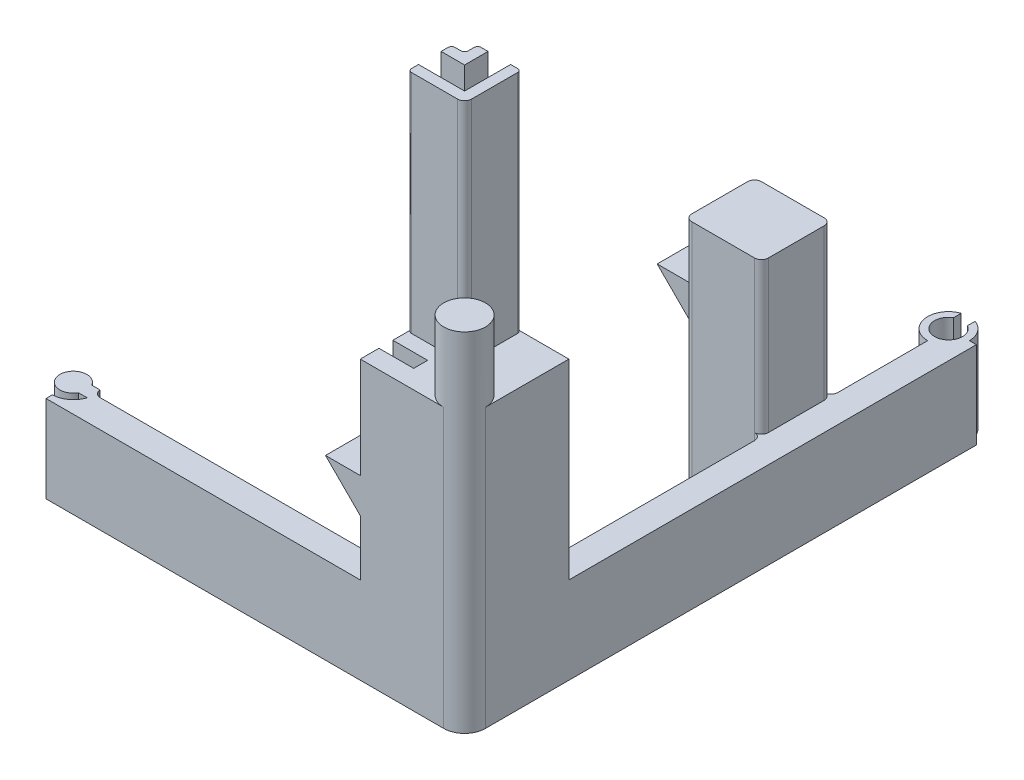
from build123d import *
from build123d.topology import SkipClean

# Parameters (mm, degrees)
SKETCH1_W                 = 30
SKETCH1_H                 = 30
BOSS_EXTRUDE1_DEPTH       = 80
SKETCH2_R                 = 6
BOSS_EXTRUDE2_DEPTH       = 20
CUT_EXTRUDE1_DEPTH        = 83.764726786
BOSS_EXTRUDE3_DEPTH       = 65
BOSS_EXTRUDE5_DEPTH       = 2
BOSS_EXTRUDE6_DEPTH       = 23
BOSS_EXTRUDE7_DEPTH       = 25
FILLET1_R                 = 2
SKETCH11_R                = 6.055782361
CUT_EXTRUDE2_DEPTH        = 2.125
SKETCH12_W                = 13.25
SKETCH12_H                = 8.5
CUT_EXTRUDE3_DEPTH        = 13.25
FILLET2_R                 = 2
CUT_EXTRUDE4_REACH        = 195.534
SKETCH14_W                = 3.75
SKETCH14_H                = 3.75
FILLET3_R                 = 1
SKETCH15_W                = 10
SKETCH15_H                = 4
CUT_EXTRUDE5_DEPTH        = 25
BOSS_EXTRUDE8_REACH       = 230.211
SKETCH17_W                = 22
SKETCH17_H                = 20
SKETCH18_W                = 17
SKETCH18_H                = 15
CUT_EXTRUDE6_DEPTH        = 66
FILLET4_R                 = 2
FILLET5_R                 = 2
CHAMFER1_SIZE             = 7
BOSS_EXTRUDE9_DEPTH       = 30
BOSS_EXTRUDE10_DEPTH      = 8
BOSS_EXTRUDE10_DEPTH_BACK = 8


with BuildPart() as part:
    # Sketch1 → Boss-Extrude1 (new body)
    with BuildSketch(Plane(origin=(0, 0, 0), x_dir=(1, 0, 0), z_dir=(0, 1, 0))):
        Rectangle(SKETCH1_W, SKETCH1_H)
    extrude(amount=BOSS_EXTRUDE1_DEPTH)

    # Sketch2 → Boss-Extrude2 (add)
    with BuildSketch(Plane(origin=(0, 80, 0), x_dir=(1, 0, 0), z_dir=(0, 1, 0))):
        with Locations(Location((9, -9, 0), (0, 0, 270))):
            Circle(SKETCH2_R)
    extrude(amount=BOSS_EXTRUDE2_DEPTH)

    # Sketch3 → Cut-Extrude1 (cut, through all)
    with BuildSketch(Plane(origin=(0, 80, 0), x_dir=(1, 0, 0), z_dir=(0, 1, 0))):
        with BuildLine():
            Line((9, -15), (15, -15))
            Line((15, -15), (15, -9))
            ThreePointArc((15, -9), (13.242640687, -13.242640687), (9, -15))
        make_face()
    extrude(amount=-CUT_EXTRUDE1_DEPTH, mode=Mode.SUBTRACT)

    # Sketch4 → Boss-Extrude3 (add)
    with BuildSketch(Plane(origin=(0, 80, 0), x_dir=(1, 0, 0), z_dir=(0, 1, 0))):
        Polygon((-8.25, 11.25), (-8.25, 8.25), (-11.25, 8.25), (-15, 8.25), (-15, 11.25), (-11.25, 11.25), (-11.25, 15), (-8.25, 15), align=None)
        Polygon((-1.75, 1.75), (-11.25, 1.75), (-15, 1.75), (-15, -1.25), (-11.25, -1.25), (1.25, -1.25), (1.25, 11.25), (1.25, 15), (-1.75, 15), (-1.75, 11.25), align=None)
    extrude(amount=BOSS_EXTRUDE3_DEPTH)

    # Sketch6 → Boss-Extrude5 (add)
    with BuildSketch(Plane.XZ):
        with BuildLine():
            Line((15, -15), (7, -15))
            Line((7, -15), (7, -126.175))
            ThreePointArc((7, -126.175), (2.757359313, -136.417640687), (13, -132.175))
            Line((13, -132.175), (15, -132.175))
            Line((15, -132.175), (15, -15))
        make_face()
    extrude(amount=-BOSS_EXTRUDE5_DEPTH)

    # Sketch7 → Boss-Extrude6 (add)
    with SkipClean():  # the faces are left unmerged after this step: merging them gives an invalid solid
        with BuildSketch(Plane(origin=(0, 2, 0), x_dir=(1, 0, 0), z_dir=(0, 1, 0))):
            with BuildLine():
                Line((9, 137.831854249), (9, 135.639101615))
                ThreePointArc((9, 135.639101615), (7, 128.175), (5, 135.639101615))
                Line((5, 135.639101615), (5, 137.831854249))
                ThreePointArc((5, 137.831854249), (1.086408642, 131.160388128), (7, 126.175))
                Line((7, 126.175), (7, 15))
                Line((7, 15), (15, 15))
                Line((15, 15), (15, 132.175))
                Line((15, 132.175), (13, 132.175))
                ThreePointArc((13, 132.175), (11.898979486, 135.639101615), (9, 137.831854249))
            make_face()
        extrude(amount=BOSS_EXTRUDE6_DEPTH)

    # Sketch9 → Boss-Extrude7 (add)
    with SkipClean():  # the faces are left unmerged after this step: merging them gives an invalid solid
        with BuildSketch(Plane.XZ):
            with BuildLine():
                Line((-15, 15), (-15, 7))
                Line((-15, 7), (-99.5, 7))
                ThreePointArc((-99.5, 7), (-99.577697751, 6.037536458), (-99.80877869, 5.1))
                Line((-99.80877869, 5.1), (-102.122778509, 5.1))
                ThreePointArc((-102.122778509, 5.1), (-109.375, 7), (-102.122778509, 8.9))
                Line((-102.122778509, 8.9), (-99.625, 8.9))
                ThreePointArc((-99.625, 8.9), (-101.816885554, 11.955834237), (-105.375001601, 13.173329766))
                Line((-105.375001601, 13.173329766), (-105.375001601, 15))
                Line((-105.375001601, 15), (-15, 15))
            make_face()
        extrude(amount=-BOSS_EXTRUDE7_DEPTH)

    # Fillet1
    fillet1_edges = [part.edges().sort_by_distance(p)[0] for p in [
        (-99.5, 12.5, 7),
    ]]
    fillet(fillet1_edges, radius=FILLET1_R)

    # Sketch11 → Cut-Extrude2 (cut)
    with SkipClean():  # the faces are left unmerged after this step: merging them gives an invalid solid
        with BuildSketch(Plane.XZ):
            with Locations((-105.5, 7)):
                Circle(SKETCH11_R)
        extrude(amount=-CUT_EXTRUDE2_DEPTH, mode=Mode.SUBTRACT)

    # Sketch12 → Cut-Extrude3 (cut)
    with SkipClean():  # the faces are left unmerged after this step: merging them gives an invalid solid
        with BuildSketch(Plane(origin=(0, 0, -15), x_dir=(-1, 0, 0), z_dir=(0, 0, -1))):
            with Locations((8.375, 72.75)):
                Rectangle(SKETCH12_W, SKETCH12_H)
        extrude(amount=-CUT_EXTRUDE3_DEPTH, mode=Mode.SUBTRACT)

    # Fillet2
    fillet2_edges = [part.edges().sort_by_distance(p)[0] for p in [
        (1.25, 112.5, 1.25),
    ]]
    fillet(fillet2_edges, radius=FILLET2_R)

    # Sketch14 → Cut-Extrude4 (cut, up to next)
    with BuildSketch(Plane(origin=(0, 80, 0), x_dir=(1, 0, 0), z_dir=(0, 1, 0)), mode=Mode.PRIVATE) as cut_extrude4_sk1:
        with Locations((-13.125, 13.125)):
            Rectangle(SKETCH14_W, SKETCH14_H)
    cut_extrude4_tool1 = extrude(cut_extrude4_sk1.sketch, amount=-CUT_EXTRUDE4_REACH, mode=Mode.PRIVATE) & part.part
    add(cut_extrude4_tool1.solids().sort_by_distance((-13.125, 80, -13.125))[0], mode=Mode.SUBTRACT)

    # Fillet3
    fillet3_edges = [part.edges().sort_by_distance(p)[0] for p in [
        (-11.25, 112.5, -15),
        (-11.25, 112.5, -11.25),
        (-15, 112.5, -11.25),
        (-15, 112.5, 1.25),
        (1.25, 112.5, -15),
    ]]
    fillet(fillet3_edges, radius=FILLET3_R)

    # Sketch15 → Cut-Extrude5 (cut)
    with SkipClean():  # the faces are left unmerged after this step: merging them gives an invalid solid
        with BuildSketch(Plane(origin=(0, 80, 0), x_dir=(1, 0, 0), z_dir=(0, 1, 0))):
            with Locations((-10, -7.625)):
                Rectangle(SKETCH15_W, SKETCH15_H)
        extrude(amount=-CUT_EXTRUDE5_DEPTH, mode=Mode.SUBTRACT)

    # Boss-Extrude8: up to this face of the body (flat: up to its plane)
    boss_extrude8_end = Plane(part.part.faces().sort_by_distance((-8.375, 68.5, -8.375))[0])
    # Sketch17 → Boss-Extrude8 (add, up to the picked face)
    with BuildSketch(Plane.XZ, mode=Mode.PRIVATE) as boss_extrude8_sk1:
        with Locations((-4, -88.38125)):
            Rectangle(SKETCH17_W, SKETCH17_H)
    boss_extrude8_tool1 = split(extrude(boss_extrude8_sk1.sketch, amount=-BOSS_EXTRUDE8_REACH, mode=Mode.PRIVATE), bisect_by=boss_extrude8_end, keep=Keep.BOTH, mode=Mode.PRIVATE)
    add(boss_extrude8_tool1.solids().sort_by(Axis((-4, 0, -88.38125), (0, 1, 0)))[0])

    # Sketch18 → Cut-Extrude6 (cut)
    with SkipClean():  # the faces are left unmerged after this step: merging them gives an invalid solid
        with BuildSketch(Plane.XZ):
            with Locations((-4, -88.38125)):
                Rectangle(SKETCH18_W, SKETCH18_H)
        extrude(amount=-CUT_EXTRUDE6_DEPTH, mode=Mode.SUBTRACT)

    # Fillet4
    fillet4_edges = [part.edges().sort_by_distance(p)[0] for p in [
        (7, 13.5, -78.38125),
        (7, 13.5, -98.38125),
        (-15, 34.25, -98.38125),
        (-15, 34.25, -78.38125),
    ]]
    fillet(fillet4_edges, radius=FILLET4_R)

    # Fillet5
    fillet5_edges = [part.edges().sort_by_distance(p)[0] for p in [
        (7, 46.75, -78.38125),
        (7, 46.75, -98.38125),
    ]]
    fillet(fillet5_edges, radius=FILLET5_R)

    # Chamfer1
    chamfer1_edges = [part.edges().sort_by_distance(p)[0] for p in [
        (-12.5, 66, -88.38125),
        (-4, 66, -80.88125),
        (4.5, 66, -88.38125),
        (-4, 66, -95.88125),
    ]]
    chamfer(chamfer1_edges, length=CHAMFER1_SIZE)

    # Sketch19 → Boss-Extrude9 (add)
    with SkipClean():  # the faces are left unmerged after this step: merging them gives an invalid solid
        with BuildSketch(Plane.XY.offset(15)):
            Polygon((-15, 41), (-15, 51), (-25, 51), align=None)
        extrude(amount=-BOSS_EXTRUDE9_DEPTH)

    # Sketch20 → Boss-Extrude10 (add, two sides: drawn at the far end of the back side and taken through both)
    with SkipClean():  # the faces are left unmerged after this step: merging them gives an invalid solid
        with BuildSketch(Plane.XY.offset(-88.38125).offset(-BOSS_EXTRUDE10_DEPTH_BACK)):
            Polygon((-15, 41), (-15, 51), (-25, 51), align=None)
        extrude(amount=BOSS_EXTRUDE10_DEPTH + BOSS_EXTRUDE10_DEPTH_BACK)


solid = part.part
